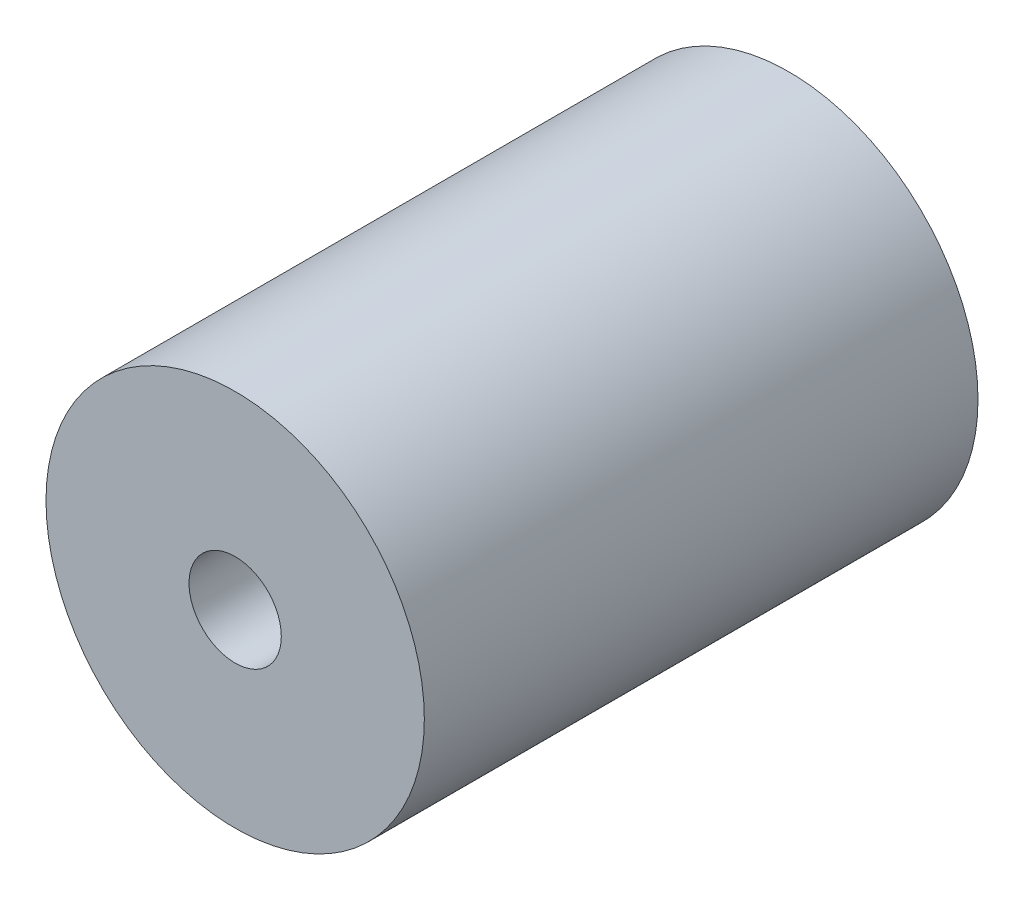
from build123d import *

# Parameters (mm, degrees)
CROQUIS1_R              = 10.25
CROQUIS1_R_2            = 2.5
SALIENTE_EXTRUIR1_DEPTH = 15
SALIENTE_EXTRUIR2_START = 15
CROQUIS2_R              = 10.25
CROQUIS2_R_2            = 4
SALIENTE_EXTRUIR2_DEPTH = 15


with BuildPart() as part:
    # Croquis1 → Saliente-Extruir1 (new body)
    with BuildSketch(Plane.XY):
        Circle(CROQUIS1_R)
        Circle(CROQUIS1_R_2, mode=Mode.SUBTRACT)
    extrude(amount=SALIENTE_EXTRUIR1_DEPTH)

    # Croquis2 → Saliente-Extruir2 (add)
    with BuildSketch(Plane(origin=(0, 0, 0), x_dir=(-1, 0, 0), z_dir=(0, 0, -1)).offset(SALIENTE_EXTRUIR2_START)):
        Circle(CROQUIS2_R)
        Circle(CROQUIS2_R_2, mode=Mode.SUBTRACT)
    extrude(amount=-SALIENTE_EXTRUIR2_DEPTH)


solid = part.part
